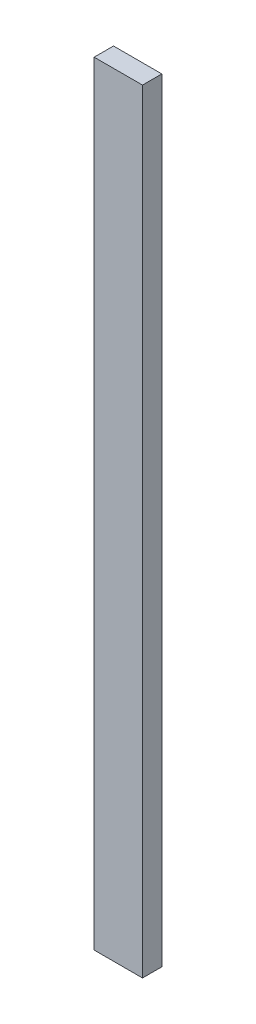
from build123d import *

# Parameters (mm, degrees)
SKETCH_1_W      = 250
SKETCH_1_H      = 4000
EXTRUDE_1_DEPTH = 100


with BuildPart() as part:
    # 草图1 → 凸台-拉伸1 (new body)
    with BuildSketch(Plane.XY):
        Rectangle(SKETCH_1_W, SKETCH_1_H)
    extrude(amount=EXTRUDE_1_DEPTH)


solid = part.part
